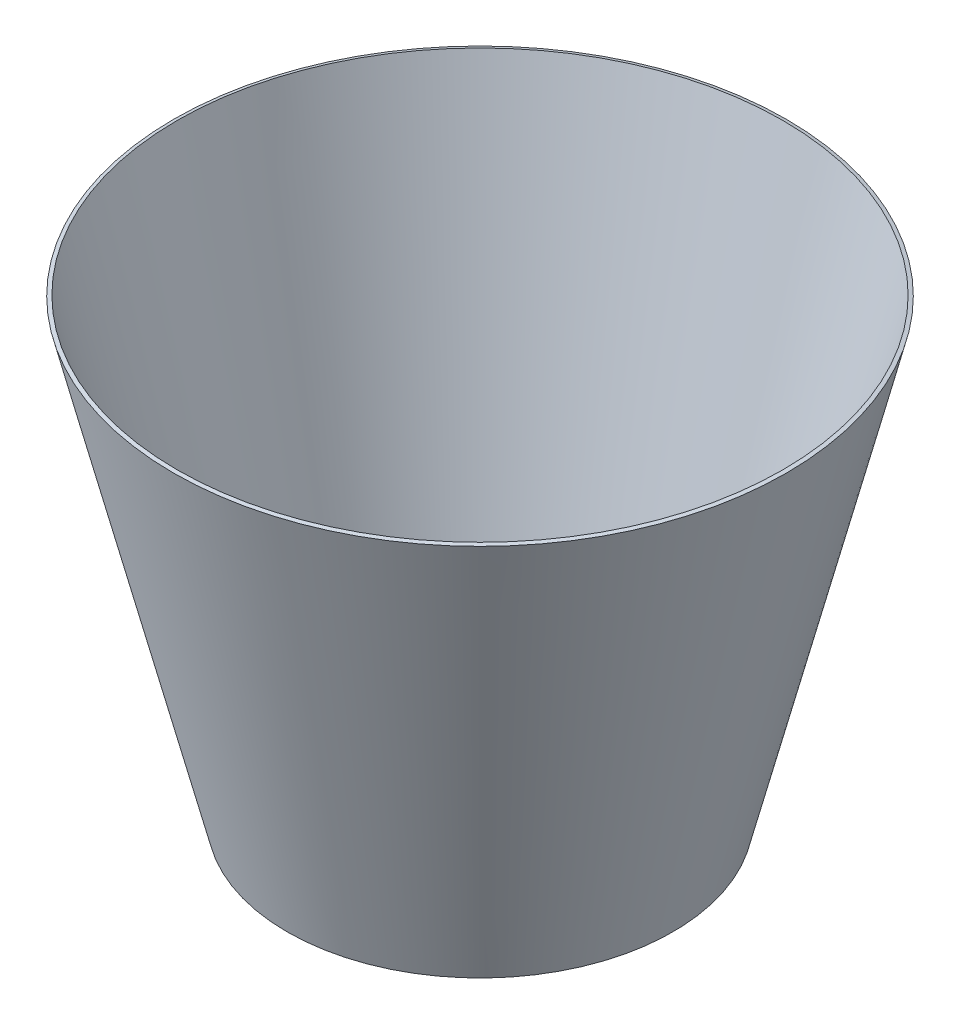
from build123d import *


with BuildPart() as part:
    # Sketch1 → Revolve-Thin1 (revolve)
    with BuildSketch(Plane.XY, mode=Mode.PRIVATE) as revolve_thin1_sk:
        Polygon((127, -251.851359517), (203.2, 52.948640483), (205.66416195, 52.332599996), (129.46416195, -252.467400004), align=None)
    revolve(revolve_thin1_sk.sketch.rotate(Axis((0, 168.054380665, 0), (0, -1, 0)), 90), axis=Axis((0, 168.054380665, 0), (0, -1, 0)))


solid = part.part
